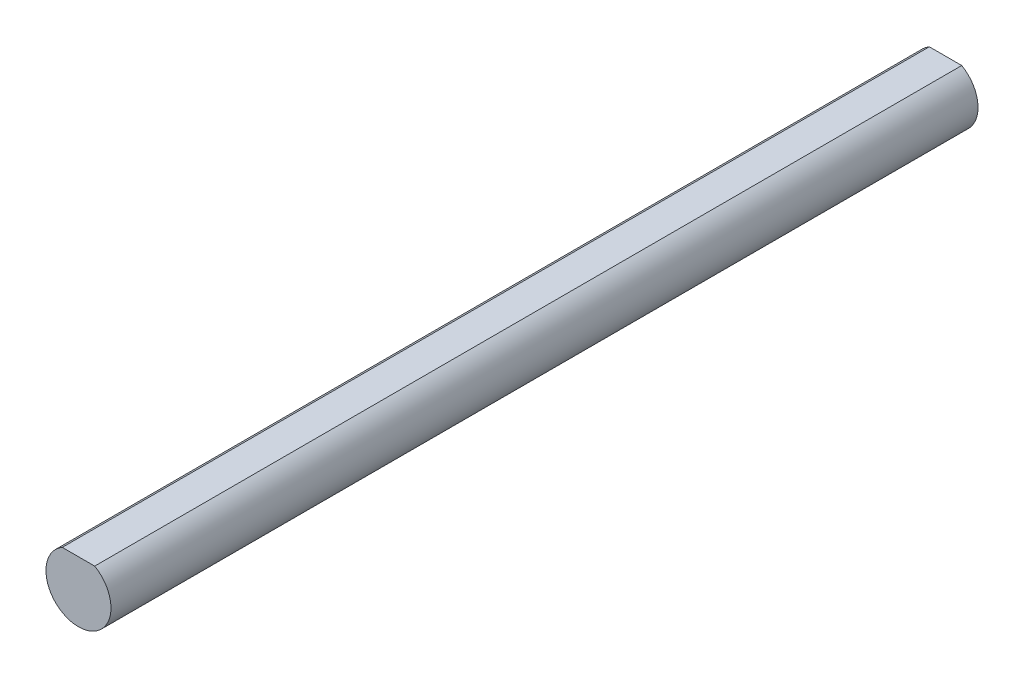
from build123d import *

# Parameters (mm, degrees)
SKETCH_1_W          = 200
SKETCH_1_H          = 7.5
SKETCH_2_W          = 20
SKETCH_2_H          = 5.5
CUT_EXTRUDE_2_DEPTH = 257.219632347


with BuildPart() as part:
    # 草图1 → 旋转1 (revolve)
    with BuildSketch(Plane(origin=(0, 0, 0), x_dir=(0, 0, -1), z_dir=(1, 0, 0)), mode=Mode.PRIVATE) as revolve_1_sk:
        with Locations((156, 3.75)):
            Rectangle(SKETCH_1_W, SKETCH_1_H)
    revolve(revolve_1_sk.sketch.rotate(Axis((0, 0, -51), (0, 0, -1)), 90), axis=Axis((0, 0, -51), (0, 0, -1)))

    # 草图2 → 切除-拉伸2 (cut, through all)
    with BuildSketch(Plane.XY):
        with Locations((0, 9.25)):
            Rectangle(SKETCH_2_W, SKETCH_2_H)
    extrude(amount=-CUT_EXTRUDE_2_DEPTH, mode=Mode.SUBTRACT)


solid = part.part
